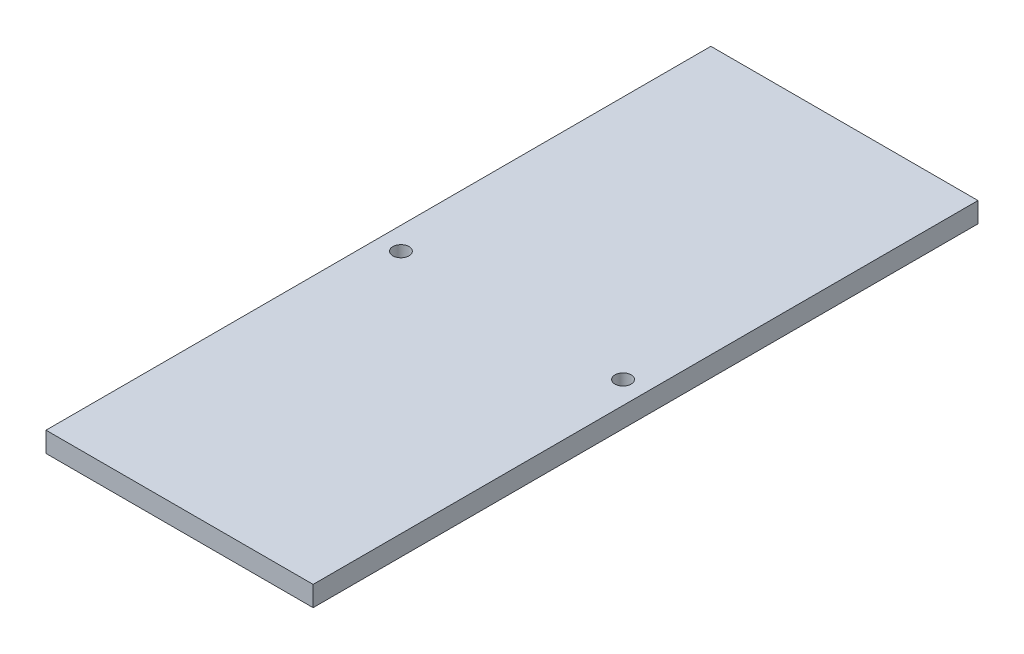
from build123d import *

# Parameters (mm, degrees)
SKETCH1_W           = 33.599994698
SKETCH1_H           = 83.630179878
SKETCH1_R           = 1.016
BOSS_EXTRUDE1_DEPTH = 2.54


with BuildPart() as part:
    # Sketch1 → Boss-Extrude1 (new body)
    with BuildSketch(Plane(origin=(0, 0, 0), x_dir=(1, 0, 0), z_dir=(0, 1, 0))):
        Rectangle(SKETCH1_W, SKETCH1_H)
        with Locations(Location((-13.97, 0, 0), (0, 0, 270))):
            Circle(SKETCH1_R, mode=Mode.SUBTRACT)
        with Locations(Location((13.97, 0, 0), (0, 0, 270))):
            Circle(SKETCH1_R, mode=Mode.SUBTRACT)
    extrude(amount=BOSS_EXTRUDE1_DEPTH)


solid = part.part
